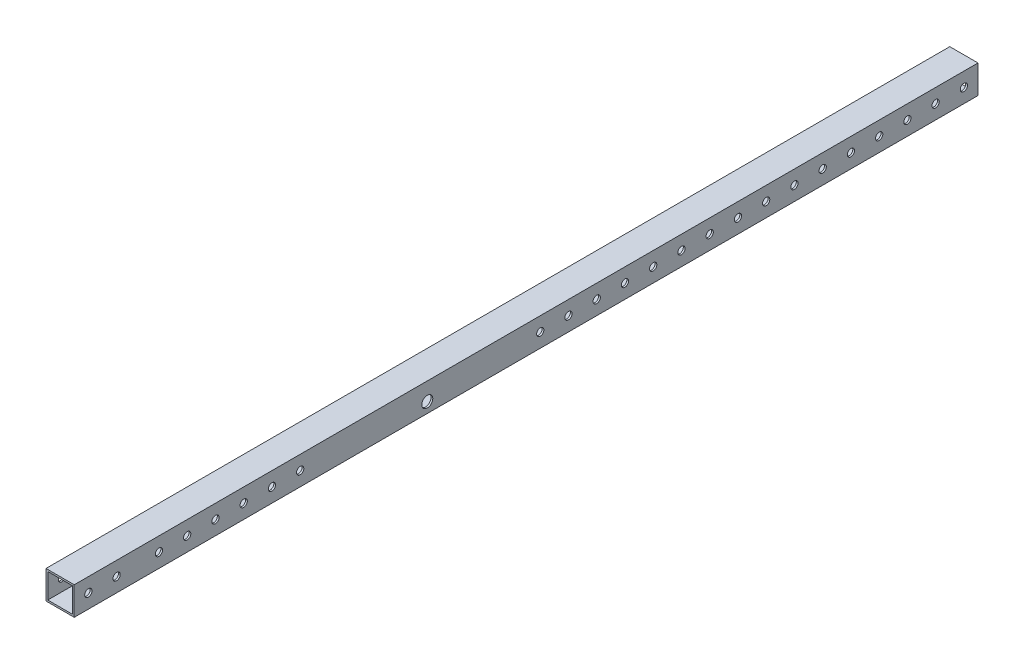
from build123d import *

# Parameters (mm, degrees)
SKETCH1_W           = 25.4
SKETCH1_H           = 25.4
SKETCH1_W_2         = 22.225
SKETCH1_H_2         = 22.225
BOSS_EXTRUDE1_DEPTH = 812.8
SKETCH2_R           = 3.2639
CUT_EXTRUDE1_DEPTH  = 814.593362805
SKETCH3_R           = 3.2639
SKETCH3_R_2         = 4.953
CUT_EXTRUDE2_DEPTH  = 814.593362805


with BuildPart() as part:
    # Sketch1 → Boss-Extrude1 (new body)
    with BuildSketch(Plane.XY):
        with Locations((12.7, 12.7)):
            Rectangle(SKETCH1_W, SKETCH1_H)
        with Locations((12.7, 12.7)):
            Rectangle(SKETCH1_W_2, SKETCH1_H_2, mode=Mode.SUBTRACT)
    extrude(amount=BOSS_EXTRUDE1_DEPTH)

    # Sketch2 → Cut-Extrude1 (cut, through all)
    with BuildSketch(Plane(origin=(25.4, 0, 0), x_dir=(0, 0, -1), z_dir=(1, 0, 0))):
        with Locations((-12.7, 12.7)):
            Circle(SKETCH2_R)
        with Locations((-38.1, 12.7)):
            Circle(SKETCH2_R)
        with Locations(Location((-774.7, 12.7, 0), (0, 0, 180))):
            Circle(SKETCH2_R)
        with Locations(Location((-800.1, 12.7, 0), (0, 0, 180))):
            Circle(SKETCH2_R)
    extrude(amount=-CUT_EXTRUDE1_DEPTH, mode=Mode.SUBTRACT)

    # Sketch3 → Cut-Extrude2 (cut, through all)
    with BuildSketch(Plane(origin=(25.4, 0, 0), x_dir=(0, 0, -1), z_dir=(1, 0, 0))):
        with Locations((-63.5, 12.7)):
            Circle(SKETCH3_R)
        with Locations((-736.6, 12.7)):
            Circle(SKETCH3_R)
        with Locations((-711.2, 12.7)):
            Circle(SKETCH3_R)
        with Locations((-685.8, 12.7)):
            Circle(SKETCH3_R)
        with Locations((-660.4, 12.7)):
            Circle(SKETCH3_R)
        with Locations((-635, 12.7)):
            Circle(SKETCH3_R)
        with Locations((-609.6, 12.7)):
            Circle(SKETCH3_R)
        with Locations((-495.3, 9.271)):
            Circle(SKETCH3_R_2)
        with Locations((-88.9, 12.7)):
            Circle(SKETCH3_R)
        with Locations((-114.3, 12.7)):
            Circle(SKETCH3_R)
        with Locations((-139.7, 12.7)):
            Circle(SKETCH3_R)
        with Locations((-165.1, 12.7)):
            Circle(SKETCH3_R)
        with Locations((-190.5, 12.7)):
            Circle(SKETCH3_R)
        with Locations((-215.9, 12.7)):
            Circle(SKETCH3_R)
        with Locations((-241.3, 12.7)):
            Circle(SKETCH3_R)
        with Locations((-266.7, 12.7)):
            Circle(SKETCH3_R)
        with Locations((-292.1, 12.7)):
            Circle(SKETCH3_R)
        with Locations((-317.5, 12.7)):
            Circle(SKETCH3_R)
        with Locations((-342.9, 12.7)):
            Circle(SKETCH3_R)
        with Locations((-368.3, 12.7)):
            Circle(SKETCH3_R)
        with Locations((-393.7, 12.7)):
            Circle(SKETCH3_R)
    extrude(amount=-CUT_EXTRUDE2_DEPTH, mode=Mode.SUBTRACT)


solid = part.part
